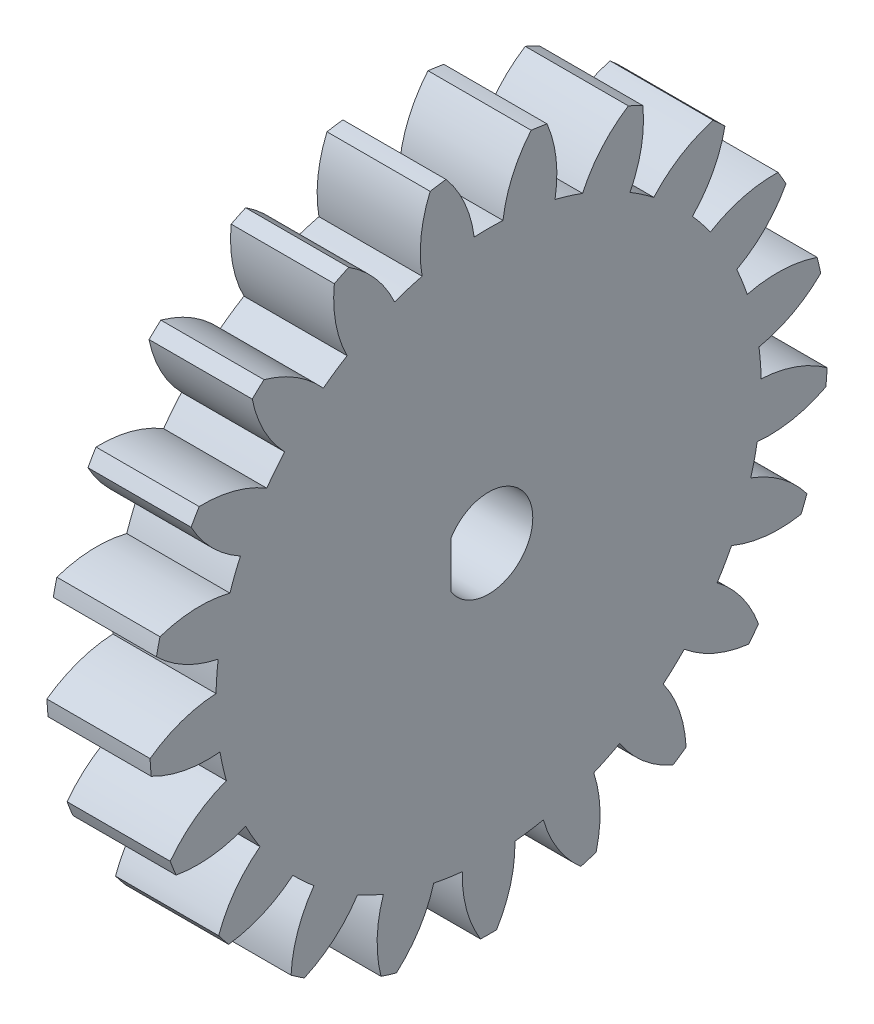
from build123d import *

# Parameters (mm, degrees)
BASPROSKE_W              = 7
BASPROSKE_H              = 23
TOOTHCUT_DEPTH           = 34.271609519
TEETHCUTS_COUNT          = 21
TEETHCUTS_ANGLE          = 342.857142857
HUBNEAONESKE_R           = 5
HUBNEARONE_DEPTH         = 5.0000508
BORSKE_R                 = 3
BORE_DEPTH               = 12.0000508
EXTRUDE_1_DEPTH          = 12.000051
CUT_EXTRUDE_START        = -5.0000508
CUT_EXTRUDE_2_DEPTH      = 5.0000508
CUT_EXTRUDE_3_DEPTH      = 34.250848963
CUT_EXTRUDE_3_DEPTH_BACK = 34.250848963
SKETCH_3_R               = 1.65


with BuildPart() as part:
    # BasProSke → Base-Revolve (revolve)
    with BuildSketch(Plane(origin=(0, 0, 0), x_dir=(1, 0, 0), z_dir=(0, 1, 0)), mode=Mode.PRIVATE) as base_revolve_sk:
        with Locations((3.5, 11.5)):
            Rectangle(BASPROSKE_W, BASPROSKE_H)
    revolve(base_revolve_sk.sketch.rotate(Axis((-10, 0, 0), (1, 0, 0)), 180), axis=Axis((-10, 0, 0), (1, 0, 0)))

    # TooCutSke → ToothCut (cut, through all)
    with BuildSketch(Plane(origin=(0, 0, 0), x_dir=(0, 0, -1), z_dir=(1, 0, 0))):
        with BuildLine():
            ThreePointArc((0.976779145, 18.473194188), (0, 18.499), (-0.976779145, 18.473194188))
            ThreePointArc((-0.976779145, 18.473194188), (-1.625451341, 20.797249275), (-2.90802115, 22.841025768))
            ThreePointArc((-2.90802115, 22.841025768), (0, 23.0254), (2.90802115, 22.841025768))
            ThreePointArc((2.90802115, 22.841025768), (1.625451341, 20.797249275), (0.976779145, 18.473194188))
        make_face()
    toothcut = extrude(amount=TOOTHCUT_DEPTH, mode=Mode.SUBTRACT)

    # TeethCuts: ToothCut ×21 about axis
    teethcuts_axis = Axis((-10, 0, 0), (1, 0, 0))
    for i in range(1, TEETHCUTS_COUNT):
        add(toothcut.rotate(teethcuts_axis, i * TEETHCUTS_ANGLE / (TEETHCUTS_COUNT - 1)), mode=Mode.SUBTRACT)

    # HubNeaOneSke → HubNearOne (add)
    with BuildSketch(Plane.ZY):
        with Locations(Location((0, 0, 0), (0, 0, 180))):
            Circle(HUBNEAONESKE_R)
    extrude(amount=HUBNEARONE_DEPTH)

    # BorSke → Bore (cut, symmetric)
    with BuildSketch(Plane(origin=(0, 0, 0), x_dir=(0, 0, -1), z_dir=(1, 0, 0))):
        with Locations(Location((0, 0, 0), (0, 0, 180))):
            Circle(BORSKE_R)
    extrude(amount=BORE_DEPTH, both=True, mode=Mode.SUBTRACT)

    # 草图1 → 凸台-拉伸1 (add, through all)
    with BuildSketch(Plane.ZY.offset(5.0000508)):
        with BuildLine():
            Line((2.55, 1.580348063), (2.55, -1.580348063))
            ThreePointArc((2.55, -1.580348063), (3, 0), (2.55, 1.580348063))
        make_face()
    extrude(amount=-EXTRUDE_1_DEPTH)

    # 草图4 → 切除-拉伸2 (cut)
    with BuildSketch(Plane.ZY.offset(5.0000508).offset(CUT_EXTRUDE_START)):
        with BuildLine():
            Line((-4, 3), (-4, -3))
            ThreePointArc((-4, -3), (-5, 0), (-4, 3))
        make_face()
        with BuildLine():
            Line((4, 3), (4, -3))
            ThreePointArc((4, -3), (5, 0), (4, 3))
        make_face()
    extrude(amount=CUT_EXTRUDE_2_DEPTH, mode=Mode.SUBTRACT)

    # 草图3 → 切除-拉伸3 (cut, two sides: drawn at the far end of the back side and taken through both)
    with BuildSketch(Plane.XY.offset(-CUT_EXTRUDE_3_DEPTH_BACK)):
        with Locations(Location((-2.5000508, 0, 0), (0, 0, 286.707134567))):
            Circle(SKETCH_3_R)
    extrude(amount=CUT_EXTRUDE_3_DEPTH + CUT_EXTRUDE_3_DEPTH_BACK, mode=Mode.SUBTRACT)


solid = part.part
